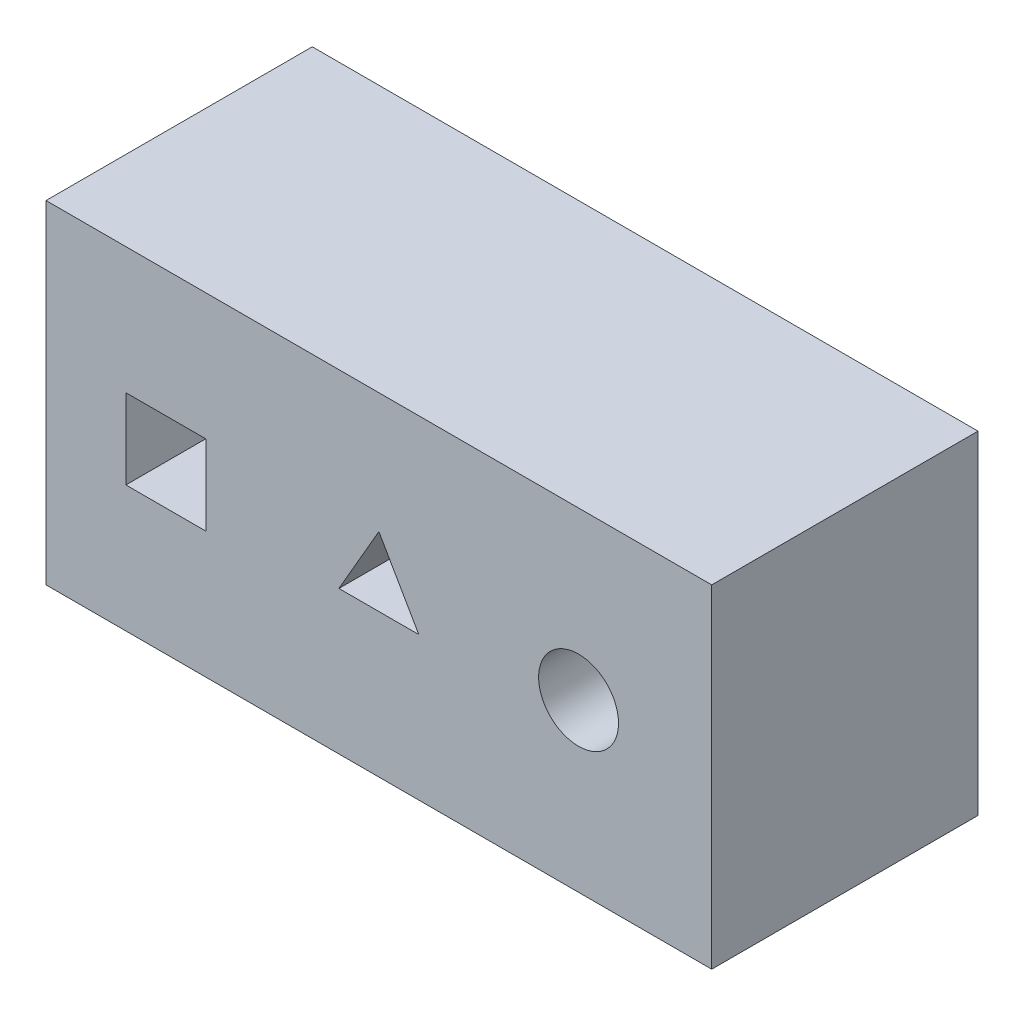
from build123d import *

# Parameters (mm, degrees)
SKETCH1_W           = 250
SKETCH1_H           = 125
SKETCH1_W_2         = 230
SKETCH1_H_2         = 115
BOSS_EXTRUDE1_DEPTH = 100
SKETCH3_W           = 250
SKETCH3_H           = 125
SKETCH3_W_2         = 230
SKETCH3_H_2         = 115
SKETCH3_R           = 15
SKETCH3_W_3         = 30
SKETCH3_H_3         = 30
BOSS_EXTRUDE4_DEPTH = 100


with BuildPart() as part:
    # Sketch1 → Boss-Extrude1 (new body)
    with BuildSketch(Plane.XY):
        Rectangle(SKETCH1_W, SKETCH1_H)
        Rectangle(SKETCH1_W_2, SKETCH1_H_2, mode=Mode.SUBTRACT)
    extrude(amount=BOSS_EXTRUDE1_DEPTH)

    # Sketch3 → Boss-Extrude4 (add)
    # profile 1 of 2: a face of its own
    with BuildSketch(Plane.XY.offset(100)):
        Rectangle(SKETCH3_W, SKETCH3_H)
        Rectangle(SKETCH3_W_2, SKETCH3_H_2, mode=Mode.SUBTRACT)
    # profile 2 of 2: a face of its own
    with BuildSketch(Plane.XY.offset(100)):
        Rectangle(SKETCH3_W_2, SKETCH3_H_2)
        with Locations((75, 0)):
            Circle(SKETCH3_R, mode=Mode.SUBTRACT)
        with Locations((-80, 0)):
            Rectangle(SKETCH3_W_3, SKETCH3_H_3, mode=Mode.SUBTRACT)
        Polygon((0, 17.320508076), (15, -8.660254038), (-15, -8.660254038), align=None, mode=Mode.SUBTRACT)
    extrude(amount=-BOSS_EXTRUDE4_DEPTH)


solid = part.part
